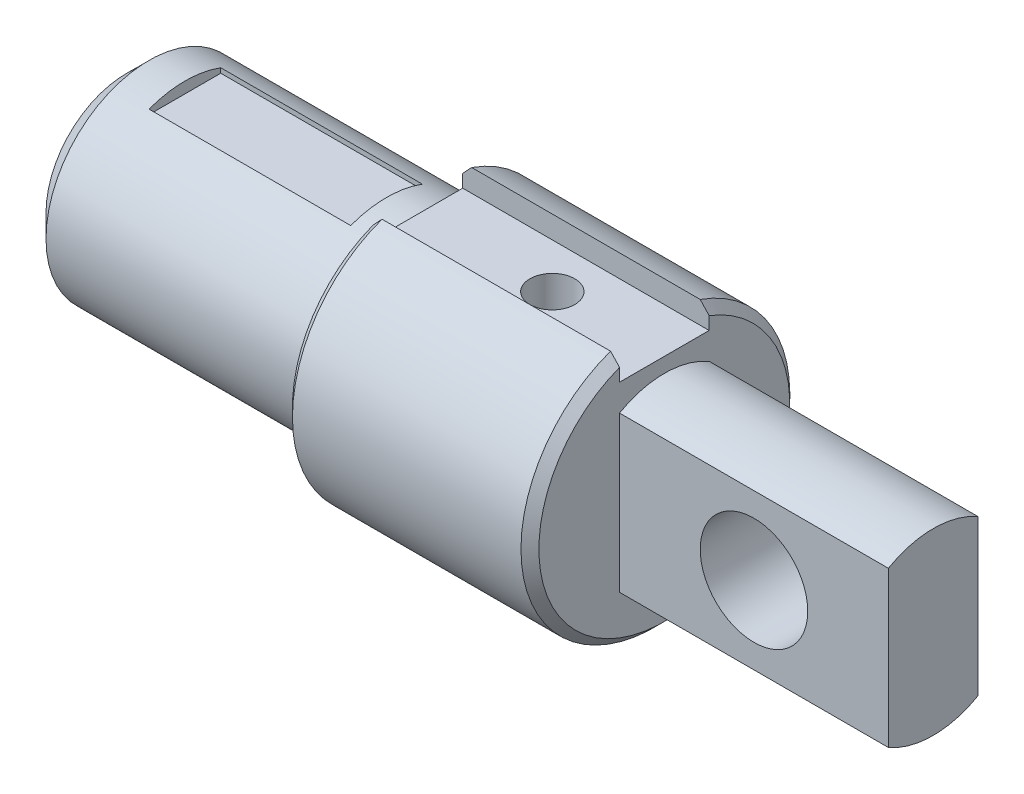
from build123d import *

# Parameters (mm, degrees)
SKETCH_2_W                  = 45
SKETCH_2_H                  = 2.5
CUT_EXTRUDE_1_DEPTH         = 8
SKETCH_4_W                  = 20
SKETCH_4_H                  = 6.715728753
CUT_EXTRUDE_2_DEPTH         = 123.576506721
HOLE_WIZARD_10_0_10_1_D     = 10
HOLE_WIZARD_10_0_10_1_DEPTH = 35
HOLE_WIZARD_10_0_10_1_TIP   = 3.004303095
CUT_EXTRUDE_START           = -60
CUT_EXTRUDE_3_DEPTH         = 245.932420089
HOLE_WIZARD_24_0_24_1_D     = 24
CHAMFER_1_SIZE              = 5
CHAMFER_2_SIZE              = 2


with BuildPart() as part:
    # Эскиз1 → Повернуть1 (revolve)
    with BuildSketch(Plane.XY, mode=Mode.PRIVATE) as revolve_1_sk:
        Polygon((0, 0), (0, 23), (65, 23), (65, 30), (120, 30), (120, 20), (180, 20), (180, 0), align=None)
    revolve(revolve_1_sk.sketch.rotate(Axis((0, 0, 0), (-1, 0, 0)), 90), axis=Axis((0, 0, 0), (-1, 0, 0)))

    # Эскиз2 → Вырез-Вытянуть1 (cut, symmetric)
    with BuildSketch(Plane.XY):
        with Locations((35.5, 21.75)):
            Rectangle(SKETCH_2_W, SKETCH_2_H)
    extrude(amount=CUT_EXTRUDE_1_DEPTH, both=True, mode=Mode.SUBTRACT)

    # Эскиз4 → Вырез-Вытянуть2 (cut, through all)
    with BuildSketch(Plane.ZY.offset(-65)):
        with Locations((0, 26.642135624)):
            Rectangle(SKETCH_4_W, SKETCH_4_H)
    extrude(amount=-CUT_EXTRUDE_2_DEPTH, mode=Mode.SUBTRACT)

    # Диаметр отверстия Ø10.0 (10)1
    with Locations(Plane(origin=(0, 23.284271247, 0), x_dir=(1, 0, 0), z_dir=(0, 1, 0))):
        with Locations((95, 0)):
            Hole(HOLE_WIZARD_10_0_10_1_D / 2, depth=HOLE_WIZARD_10_0_10_1_DEPTH)
            with Locations((0, 0, -(HOLE_WIZARD_10_0_10_1_DEPTH + HOLE_WIZARD_10_0_10_1_TIP / 2))):  # 118° drill point
                Cone(0, HOLE_WIZARD_10_0_10_1_D / 2, HOLE_WIZARD_10_0_10_1_TIP, mode=Mode.SUBTRACT)

    # Эскиз7 → Вырез-Вытянуть3 (cut)
    with BuildSketch(Plane(origin=(180, 0, 0), x_dir=(0, 0, -1), z_dir=(1, 0, 0)).offset(CUT_EXTRUDE_START)):
        Polygon((-10, 151.24355653), (-10, 17.320508076), (-10, -17.320508076), (-10, -151.24355653), (-277.846096908, -151.24355653), (-277.846096908, 151.24355653), align=None)
    cut_extrude_3 = extrude(amount=CUT_EXTRUDE_3_DEPTH, mode=Mode.SUBTRACT)

    # Зеркальное отражение1: Вырез-Вытянуть3 across plane
    add(cut_extrude_3.mirror(Plane.XY), mode=Mode.SUBTRACT)

    # Диаметр отверстия Ø24.0 (24)1 (through all)
    with Locations(Plane.XY.offset(10)):
        with Locations((150, 0)):
            Hole(HOLE_WIZARD_24_0_24_1_D / 2)

    # Фаска1
    chamfer_1_edges = [part.edges().sort_by_distance(p)[0] for p in [
        (0, 0, 23),
    ]]
    chamfer(chamfer_1_edges, length=CHAMFER_1_SIZE)

    # Фаска2
    chamfer_2_edges = [part.edges().sort_by_distance(p)[0] for p in [
        (120, -30, 0),
        (65, -30, 0),
    ]]
    chamfer(chamfer_2_edges, length=CHAMFER_2_SIZE)


solid = part.part
